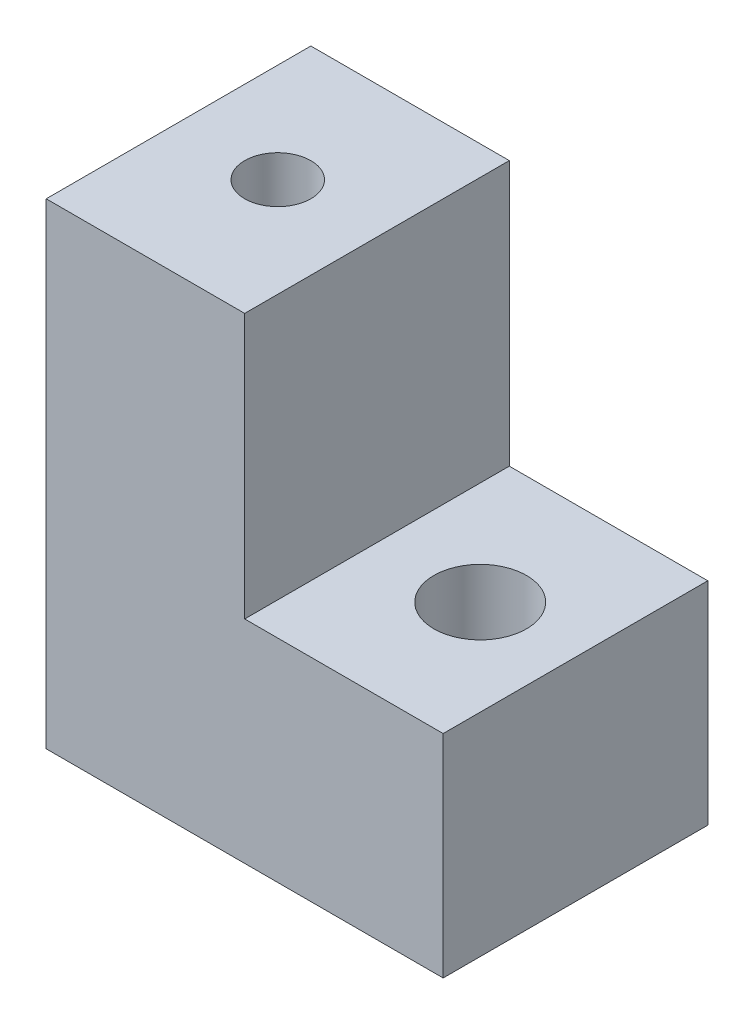
from build123d import *

# Parameters (mm, degrees)
BOSS_EXTRUDE1_DEPTH   = 10
SKETCH6_R             = 1.75
CUT_EXTRUDE1_DEPTH    = 6
F_2_5MM_DOWEL_HOLE1_D = 2.5
SKETCH9_R             = 1.75
CUT_EXTRUDE2_DEPTH    = 15
F_2_5MM_DOWEL_HOLE2_D = 2.5


with BuildPart() as part:
    # Sketch1 → Boss-Extrude1 (new body)
    with BuildSketch(Plane.XY):
        Polygon((0, 0), (-15, 0), (-15, 18), (-7.5, 18), (-7.5, 8), (0, 8), align=None)
    extrude(amount=BOSS_EXTRUDE1_DEPTH)

    # Sketch6 → Cut-Extrude1 (cut)
    with BuildSketch(Plane(origin=(0, 8, 0), x_dir=(1, 0, 0), z_dir=(0, 1, 0))):
        with Locations(Location((-3.6, -5, 0), (0, 0, 270))):
            Circle(SKETCH6_R)
    extrude(amount=-CUT_EXTRUDE1_DEPTH, mode=Mode.SUBTRACT)

    # Ø2.5mm Dowel Hole1 (through all)
    with Locations(Plane(origin=(0, 2, 0), x_dir=(1, 0, 0), z_dir=(0, 1, 0))):
        with Locations((-3.6, -5)):
            Hole(F_2_5MM_DOWEL_HOLE1_D / 2)

    # Sketch9 → Cut-Extrude2 (cut)
    with BuildSketch(Plane.XZ):
        with Locations(Location((-11.25, 5, 0), (0, 0, 270))):
            Circle(SKETCH9_R)
    extrude(amount=-CUT_EXTRUDE2_DEPTH, mode=Mode.SUBTRACT)

    # Ø2.5mm Dowel Hole2 (through all)
    with Locations(Plane(origin=(0, 15, 0), x_dir=(-1, 0, 0), z_dir=(0, -1, 0))):
        with Locations((11.25, -5)):
            Hole(F_2_5MM_DOWEL_HOLE2_D / 2)


solid = part.part
